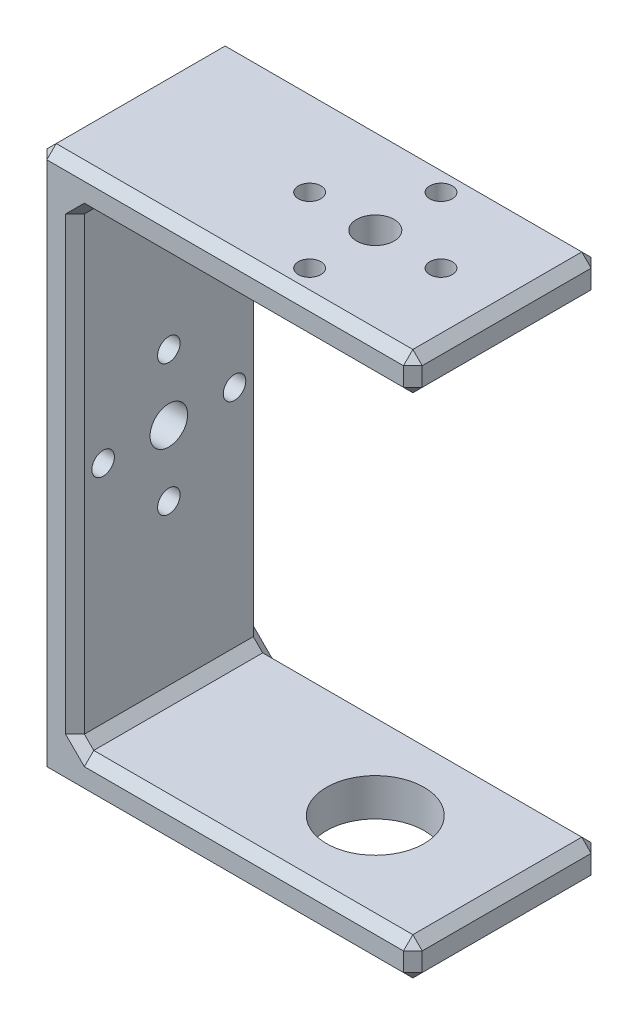
from build123d import *

# Parameters (mm, degrees)
SKETCH1_W           = 20
SKETCH1_H           = 50
BOSS_EXTRUDE1_DEPTH = 4
SKETCH2_W           = 40
SKETCH2_H           = 20
BOSS_EXTRUDE2_DEPTH = 4
SKETCH3_R           = 1.2
SKETCH3_R_2         = 2
CUT_EXTRUDE1_DEPTH  = 4
SKETCH4_W           = 40
SKETCH4_H           = 20
BOSS_EXTRUDE3_DEPTH = 4
SKETCH5_R           = 5.2
CUT_EXTRUDE2_DEPTH  = 4
CHAMFER1_SIZE       = 1
SKETCH6_R           = 2
SKETCH6_R_2         = 1.2
CUT_EXTRUDE3_DEPTH  = 10


with BuildPart() as part:
    # Sketch1 → Boss-Extrude1 (new body)
    with BuildSketch(Plane(origin=(0, 0, 0), x_dir=(0, 0, -1), z_dir=(1, 0, 0))):
        Rectangle(SKETCH1_W, SKETCH1_H)
    extrude(amount=BOSS_EXTRUDE1_DEPTH)

    # Sketch2 → Boss-Extrude2 (add)
    with BuildSketch(Plane(origin=(0, 25, 0), x_dir=(1, 0, 0), z_dir=(0, 1, 0))):
        with Locations((20, 0)):
            Rectangle(SKETCH2_W, SKETCH2_H)
    extrude(amount=BOSS_EXTRUDE2_DEPTH)

    # Sketch3 → Cut-Extrude1 (cut)
    with BuildSketch(Plane(origin=(0, 29, 0), x_dir=(1, 0, 0), z_dir=(0, 1, 0))):
        with Locations(Location((33, 0, 0), (0, 0, 270))):
            Circle(SKETCH3_R)
        with Locations(Location((26, 0, 0), (0, 0, 270))):
            Circle(SKETCH3_R_2)
        with Locations(Location((26, -7, 0), (0, 0, 270))):
            Circle(SKETCH3_R)
        with Locations(Location((19, 0, 0), (0, 0, 270))):
            Circle(SKETCH3_R)
        with Locations(Location((26, 7, 0), (0, 0, 270))):
            Circle(SKETCH3_R)
    extrude(amount=-CUT_EXTRUDE1_DEPTH, mode=Mode.SUBTRACT)

    # Sketch4 → Boss-Extrude3 (add)
    with BuildSketch(Plane.XZ.offset(25)):
        with Locations((20, 0)):
            Rectangle(SKETCH4_W, SKETCH4_H)
    extrude(amount=BOSS_EXTRUDE3_DEPTH)

    # Sketch5 → Cut-Extrude2 (cut)
    with BuildSketch(Plane.XZ.offset(29)):
        with Locations(Location((26, 0, 0), (0, 0, 270))):
            Circle(SKETCH5_R)
    extrude(amount=-CUT_EXTRUDE2_DEPTH, mode=Mode.SUBTRACT)

    # Chamfer1
    chamfer1_edges = [part.edges().sort_by_distance(p)[0] for p in [
        (4, 0, 10),
        (4, -25, 0),
        (22, 25, 10),
        (40, 25, 0),
        (40, 27, 10),
        (22, 25, -10),
        (40, 27, -10),
        (0, 29, 0),
        (20, 29, 10),
        (40, 29, 0),
        (20, 29, -10),
        (4, 0, -10),
        (0, 0, 10),
        (22, -25, -10),
        (40, -25, 0),
        (40, -27, -10),
        (22, -25, 10),
        (40, -27, 10),
        (0, -29, 0),
        (20, -29, -10),
        (40, -29, 0),
        (20, -29, 10),
        (0, 0, -10),
        (4, 25, 0),
    ]]
    chamfer(chamfer1_edges, length=CHAMFER1_SIZE)

    # Sketch6 → Cut-Extrude3 (cut)
    with BuildSketch(Plane.ZY):
        Circle(SKETCH6_R)
        with Locations((7, 0)):
            Circle(SKETCH6_R_2)
        with Locations((0, -7)):
            Circle(SKETCH6_R_2)
        with Locations((-7, 0)):
            Circle(SKETCH6_R_2)
        with Locations((0, 7)):
            Circle(SKETCH6_R_2)
    extrude(amount=-CUT_EXTRUDE3_DEPTH, mode=Mode.SUBTRACT)


solid = part.part
